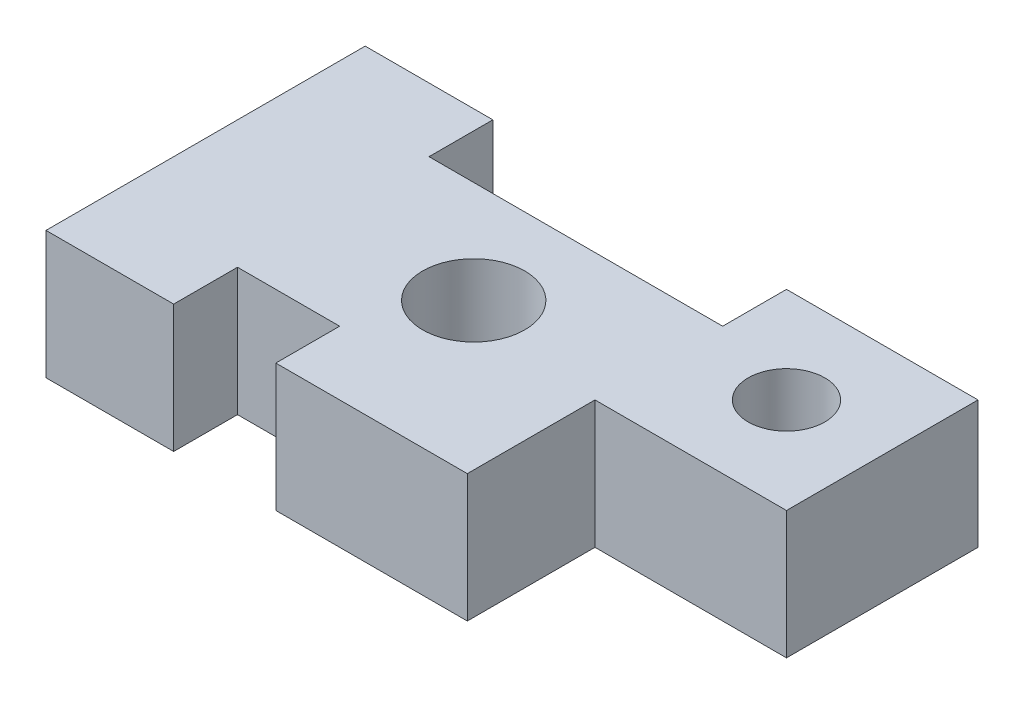
from build123d import *

# Parameters (mm, degrees)
SKETCH1_R           = 40
SKETCH1_R_2         = 30
BOSS_EXTRUDE1_DEPTH = 100


with BuildPart() as part:
    # Sketch1 → Boss-Extrude1 (new body)
    with BuildSketch(Plane(origin=(0, 0, 0), x_dir=(1, 0, 0), z_dir=(0, 1, 0))):
        Polygon((0, 0), (100, 0), (100, 50), (180, 50), (180, 0), (330, 0), (330, 100), (480, 100), (480, 250), (330, 250), (330, 200), (100, 200), (100, 250), (0, 250), align=None)
        with Locations(Location((215, 120, 0), (0, 0, 90))):
            Circle(SKETCH1_R, mode=Mode.SUBTRACT)
        with Locations(Location((405, 175, 0), (0, 0, 90))):
            Circle(SKETCH1_R_2, mode=Mode.SUBTRACT)
    extrude(amount=BOSS_EXTRUDE1_DEPTH)


solid = part.part
